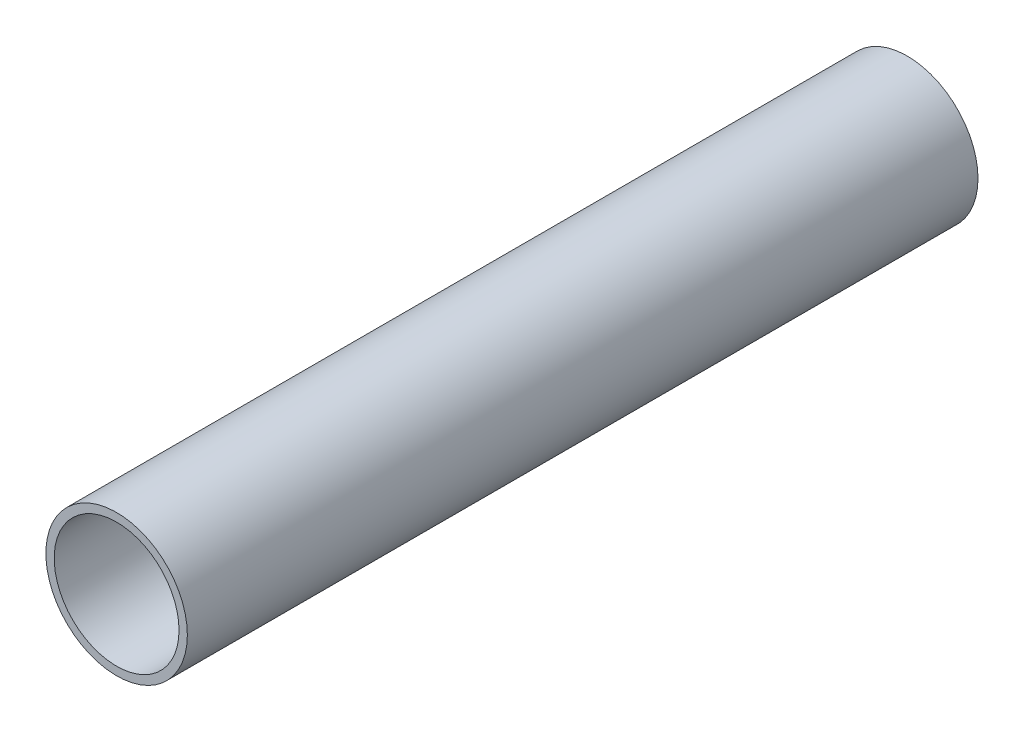
from build123d import *

# Parameters (mm, degrees)
SKETCH1_R           = 17
SKETCH1_R_2         = 15
BOSS_EXTRUDE1_DEPTH = 95


with BuildPart() as part:
    # Sketch1 → Boss-Extrude1 (new, symmetric)
    with BuildSketch(Plane.XY):
        Circle(SKETCH1_R)
        Circle(SKETCH1_R_2, mode=Mode.SUBTRACT)
    extrude(amount=BOSS_EXTRUDE1_DEPTH, both=True)


solid = part.part
